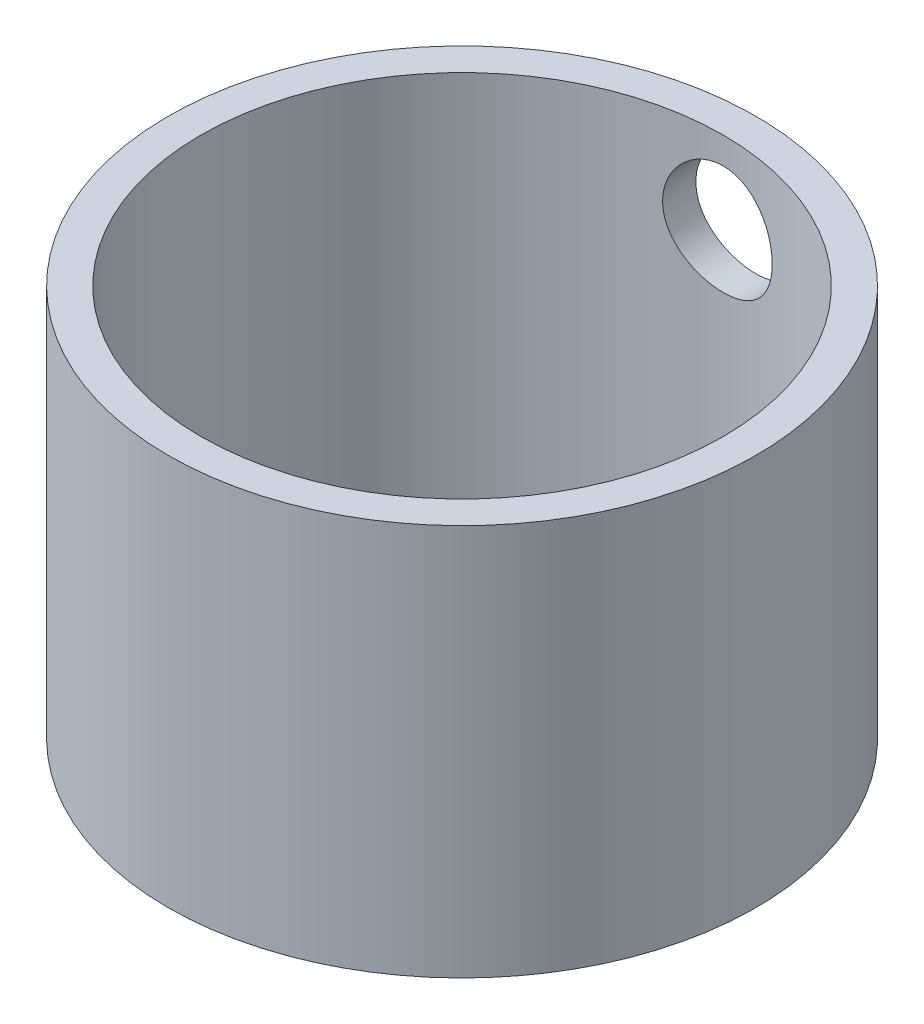
from build123d import *

# Parameters (mm, degrees)
SKETCH1_R               = 57.15
SKETCH1_R_2             = 50.8
BOSS_EXTRUDE1_DEPTH     = 76.2
CUT_EXTRUDE1_REACH      = 113.08
CUT_EXTRUDE1_END_RADIUS = 57.15
SKETCH2_R               = 10.668


with BuildPart() as part:
    # Sketch1 → Boss-Extrude1 (new body)
    with BuildSketch(Plane(origin=(0, 0, 0), x_dir=(1, 0, 0), z_dir=(0, 1, 0))):
        with Locations(Location((0, 0, 0), (0, 0, 90))):
            Circle(SKETCH1_R)
        with Locations(Location((0, 0, 0), (0, 0, 90))):
            Circle(SKETCH1_R_2, mode=Mode.SUBTRACT)
    extrude(amount=BOSS_EXTRUDE1_DEPTH)

    # Cut-Extrude1: up to this cylinder (the profile starts inside it)
    cut_extrude1_end = Plane(origin=(0, 60.325, 0), z_dir=(0, -1, 0)) * Cylinder(CUT_EXTRUDE1_END_RADIUS, 341.46, mode=Mode.PRIVATE)
    # Sketch2 → Cut-Extrude1 (cut, up to the surface)
    with BuildSketch(Plane.XY, mode=Mode.PRIVATE) as cut_extrude1_sk1:
        with Locations((0, 60.325)):
            Circle(SKETCH2_R)
    cut_extrude1_tool1 = extrude(cut_extrude1_sk1.sketch, amount=-CUT_EXTRUDE1_REACH, mode=Mode.PRIVATE) & cut_extrude1_end
    add(cut_extrude1_tool1.solids().sort_by_distance((0, 60.325, 0))[0], mode=Mode.SUBTRACT)


solid = part.part
